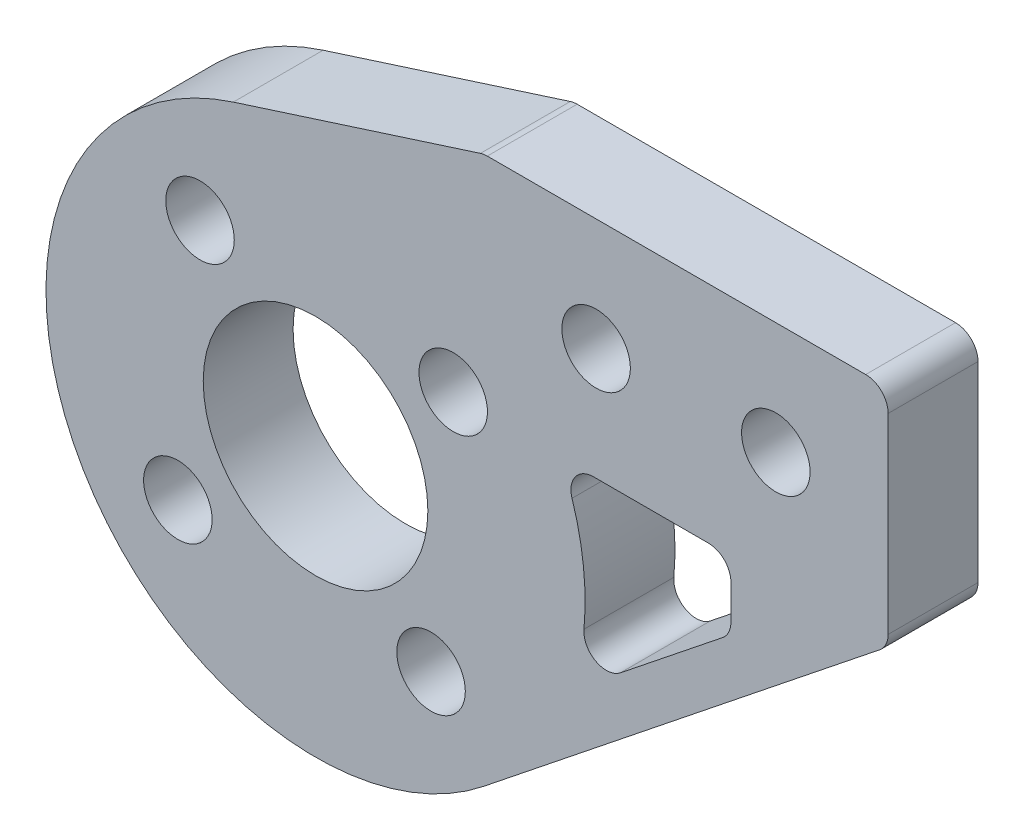
from build123d import *

# Parameters (mm, degrees)
SKETCH_1_R          = 1.525
SKETCH_1_R_2        = 5
EXTRUDE_1_DEPTH     = 4
CUT_EXTRUDE_START   = -4
CUT_EXTRUDE_1_DEPTH = 4
FILLET_1_R          = 1


with BuildPart() as part:
    # 草图1 → 凸台-拉伸1 (new body)
    # profile 1 of 2: a face of its own
    with BuildSketch(Plane.XY):
        with BuildLine():
            ThreePointArc((12, 0), (7.073549415, 9.693549333), (-3.660816447, 11.427966702))
            ThreePointArc((-3.660816447, 11.427966702), (-10.576904144, -5.668253587), (7.48855525, -9.376648669))
            ThreePointArc((7.48855525, -9.376648669), (10.813479158, -5.202755856), (12, 0))
        make_face()
        with Locations((5.142300877, -6.128355545)):
            Circle(SKETCH_1_R, mode=Mode.SUBTRACT)
        with Locations((-6.128355545, -5.142300877)):
            Circle(SKETCH_1_R, mode=Mode.SUBTRACT)
        Circle(SKETCH_1_R_2, mode=Mode.SUBTRACT)
        with Locations((-5.142300877, 6.128355545)):
            Circle(SKETCH_1_R, mode=Mode.SUBTRACT)
        with Locations((6.128355545, 5.142300877)):
            Circle(SKETCH_1_R, mode=Mode.SUBTRACT)
    # profile 2 of 2: a face of its own
    with BuildSketch(Plane.XY):
        with BuildLine():
            Line((25.489995997, 5), (25.489995997, 15))
            Line((25.489995997, 15), (7.489995997, 15))
            Line((7.489995997, 15), (-3.660816447, 11.427966702))
            ThreePointArc((-3.660816447, 11.427966702), (7.073549415, 9.693549333), (12, 0))
            ThreePointArc((12, 0), (10.813479158, -5.202755856), (7.48855525, -9.376648669))
            Line((7.48855525, -9.376648669), (25.489995997, 5))
        make_face()
        with Locations((12.489995997, 10)):
            Circle(SKETCH_1_R, mode=Mode.SUBTRACT)
        with Locations((20.489995997, 10)):
            Circle(SKETCH_1_R, mode=Mode.SUBTRACT)
    extrude(amount=EXTRUDE_1_DEPTH)

    # 草图2 → 切除-拉伸1 (cut)
    with BuildSketch(Plane.XY.offset(4).offset(CUT_EXTRUDE_START)):
        with BuildLine():
            ThreePointArc((12, 0), (11.855024322, -1.85967694), (11.42360028, -3.674419227))
            Line((11.42360028, -3.674419227), (18.489995997, 1.969078425))
            Line((18.489995997, 1.969078425), (18.489995997, 5))
            Line((18.489995997, 5), (10.908712115, 5))
            ThreePointArc((10.908712115, 5), (11.724004123, 2.558852734), (12, 0))
        make_face()
    extrude(amount=CUT_EXTRUDE_1_DEPTH, mode=Mode.SUBTRACT)

    # 圆角1
    fillet_1_edges = [part.edges().sort_by_distance(p)[0] for p in [
        (7.489995997, 15, 2),
        (25.489995997, 15, 2),
        (25.489995997, 5, 2),
        (11.42360028, -3.674419227, 2),
        (10.908712115, 5, 2),
        (18.489995997, 5, 2),
        (18.489995997, 1.969078425, 2),
    ]]
    fillet(fillet_1_edges, radius=FILLET_1_R)


solid = part.part
